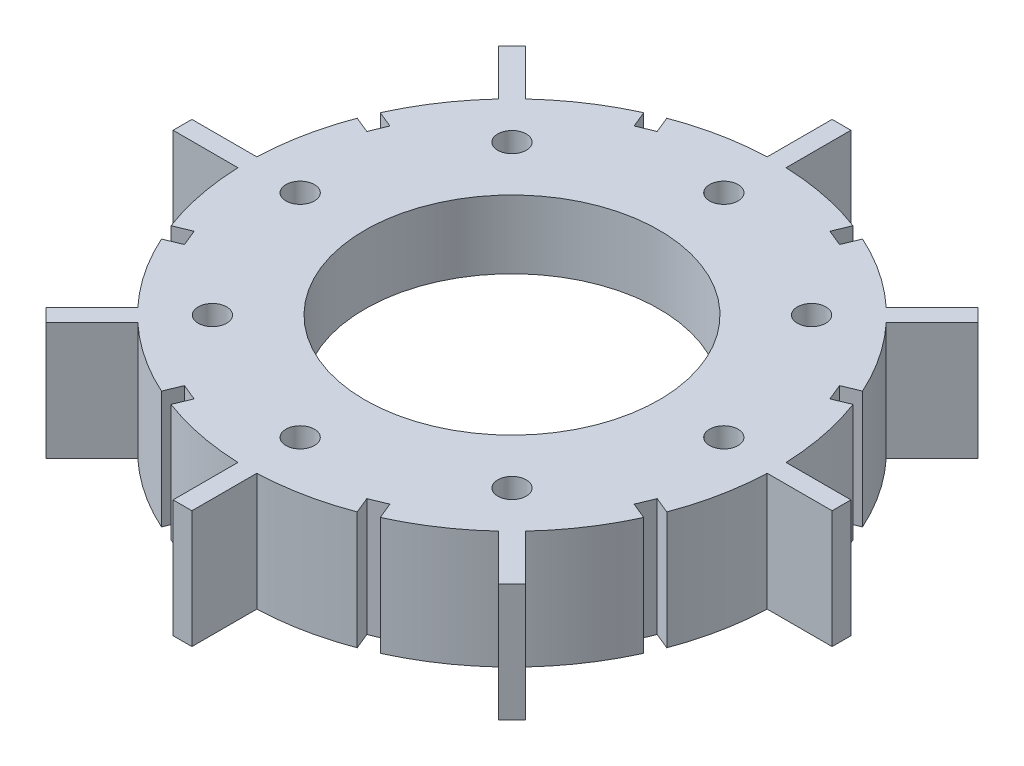
from build123d import *

# Parameters (mm, degrees)
SKETCH1_R           = 62.5
BOSS_EXTRUDE1_DEPTH = 25
SKETCH3_W           = 40
SKETCH3_H           = 21
SKETCH7_R           = 6.05
CUT_EXTRUDE1_DEPTH  = 205.205778567
SCALE1_SCALE        = 0.25


with BuildPart() as part:
    # Sketch1 → Boss-Extrude1 (new, symmetric)
    with BuildSketch(Plane(origin=(0, 0, 0), x_dir=(1, 0, 0), z_dir=(0, 1, 0))):
        with BuildLine():
            Line((95.514529523, 43.622384283), (102.443626017, 46.492510026))
            ThreePointArc((102.443626017, 46.492510026), (93.609761087, 62.397617177), (82.327640957, 76.670786708))
            Line((82.327640957, 76.670786708), (101.823376491, 96.166522241))
            Line((101.823376491, 96.166522241), (96.166522241, 101.823376491))
            Line((96.166522241, 101.823376491), (76.670786708, 82.327640957))
            ThreePointArc((76.670786708, 82.327640957), (62.397617177, 93.609761087), (46.492510026, 102.443626017))
            Line((46.492510026, 102.443626017), (43.622384283, 95.514529523))
            Line((43.622384283, 95.514529523), (36.693287789, 98.384655266))
            Line((36.693287789, 98.384655266), (39.563413532, 105.31375176))
            ThreePointArc((39.563413532, 105.31375176), (22.070318614, 110.313875085), (4, 112.4288664))
            Line((4, 112.4288664), (4, 140))
            Line((4, 140), (-4, 140))
            Line((-4, 140), (-4, 112.4288664))
            ThreePointArc((-4, 112.4288664), (-22.070318614, 110.313875085), (-39.563413532, 105.31375176))
            Line((-39.563413532, 105.31375176), (-36.693287789, 98.384655266))
            Line((-36.693287789, 98.384655266), (-43.622384283, 95.514529523))
            Line((-43.622384283, 95.514529523), (-46.492510026, 102.443626017))
            ThreePointArc((-46.492510026, 102.443626017), (-62.397617177, 93.609761087), (-76.670786708, 82.327640957))
            Line((-76.670786708, 82.327640957), (-96.166522241, 101.823376491))
            Line((-96.166522241, 101.823376491), (-101.823376491, 96.166522241))
            Line((-101.823376491, 96.166522241), (-82.327640957, 76.670786708))
            ThreePointArc((-82.327640957, 76.670786708), (-93.609761087, 62.397617177), (-102.443626017, 46.492510026))
            Line((-102.443626017, 46.492510026), (-95.514529523, 43.622384283))
            Line((-95.514529523, 43.622384283), (-98.384655266, 36.693287789))
            Line((-98.384655266, 36.693287789), (-105.31375176, 39.563413532))
            ThreePointArc((-105.31375176, 39.563413532), (-110.313875085, 22.070318614), (-112.4288664, 4))
            Line((-112.4288664, 4), (-140, 4))
            Line((-140, 4), (-140, -4))
            Line((-140, -4), (-112.4288664, -4))
            ThreePointArc((-112.4288664, -4), (-110.313875085, -22.070318614), (-105.31375176, -39.563413532))
            Line((-105.31375176, -39.563413532), (-98.384655266, -36.693287789))
            Line((-98.384655266, -36.693287789), (-95.514529523, -43.622384283))
            Line((-95.514529523, -43.622384283), (-102.443626017, -46.492510026))
            ThreePointArc((-102.443626017, -46.492510026), (-93.609761087, -62.397617177), (-82.327640957, -76.670786708))
            Line((-82.327640957, -76.670786708), (-101.823376491, -96.166522241))
            Line((-101.823376491, -96.166522241), (-96.166522241, -101.823376491))
            Line((-96.166522241, -101.823376491), (-76.670786708, -82.327640957))
            ThreePointArc((-76.670786708, -82.327640957), (-62.397617177, -93.609761087), (-46.492510026, -102.443626017))
            Line((-46.492510026, -102.443626017), (-43.622384283, -95.514529523))
            Line((-43.622384283, -95.514529523), (-36.693287789, -98.384655266))
            Line((-36.693287789, -98.384655266), (-39.563413532, -105.31375176))
            ThreePointArc((-39.563413532, -105.31375176), (-22.070318614, -110.313875085), (-4, -112.4288664))
            Line((-4, -112.4288664), (-4, -140))
            Line((-4, -140), (4, -140))
            Line((4, -140), (4, -112.4288664))
            ThreePointArc((4, -112.4288664), (22.070318614, -110.313875085), (39.563413532, -105.31375176))
            Line((39.563413532, -105.31375176), (36.693287789, -98.384655266))
            Line((36.693287789, -98.384655266), (43.622384283, -95.514529523))
            Line((43.622384283, -95.514529523), (46.492510026, -102.443626017))
            ThreePointArc((46.492510026, -102.443626017), (62.397617177, -93.609761087), (76.670786708, -82.327640957))
            Line((76.670786708, -82.327640957), (96.166522241, -101.823376491))
            Line((96.166522241, -101.823376491), (101.823376491, -96.166522241))
            Line((101.823376491, -96.166522241), (82.327640957, -76.670786708))
            ThreePointArc((82.327640957, -76.670786708), (93.609761087, -62.397617177), (102.443626017, -46.492510026))
            Line((102.443626017, -46.492510026), (95.514529523, -43.622384283))
            Line((95.514529523, -43.622384283), (98.384655266, -36.693287789))
            Line((98.384655266, -36.693287789), (105.31375176, -39.563413532))
            ThreePointArc((105.31375176, -39.563413532), (110.313875085, -22.070318614), (112.4288664, -4))
            Line((112.4288664, -4), (140, -4))
            Line((140, -4), (140, 4))
            Line((140, 4), (112.4288664, 4))
            ThreePointArc((112.4288664, 4), (110.313875085, 22.070318614), (105.31375176, 39.563413532))
            Line((105.31375176, 39.563413532), (98.384655266, 36.693287789))
            Line((98.384655266, 36.693287789), (95.514529523, 43.622384283))
        make_face()
        Circle(SKETCH1_R, mode=Mode.SUBTRACT)
    extrude(amount=BOSS_EXTRUDE1_DEPTH, both=True)

    # Sketch3 → Cut-Revolve1 (revolve, cut)
    with BuildSketch(Plane.XY):
        with Locations((-82.5, -14.5)):
            Rectangle(SKETCH3_W, SKETCH3_H)
    revolve(axis=Axis((0, 65.266274402, 0), (0, -1, 0)), mode=Mode.SUBTRACT)

    # Sketch7 → Cut-Extrude1 (cut, through all)
    with BuildSketch(Plane(origin=(0, 25, 0), x_dir=(1, 0, 0), z_dir=(0, 1, 0))):
        with Locations((0, 90)):
            Circle(SKETCH7_R)
        with Locations((63.639610307, 63.639610307)):
            Circle(SKETCH7_R)
        with Locations((90, 0)):
            Circle(SKETCH7_R)
        with Locations((63.639610307, -63.639610307)):
            Circle(SKETCH7_R)
        with Locations((0, -90)):
            Circle(SKETCH7_R)
        with Locations((-63.639610307, -63.639610307)):
            Circle(SKETCH7_R)
        with Locations((-90, 0)):
            Circle(SKETCH7_R)
        with Locations((-63.639610307, 63.639610307)):
            Circle(SKETCH7_R)
    extrude(amount=-CUT_EXTRUDE1_DEPTH, mode=Mode.SUBTRACT)


with BuildPart() as part_1:
    # Scale1: scaled about (0, 6.17055907, 0)
    add(part.part.scale(SCALE1_SCALE).moved(Location((0, 4.627919303, 0))))


solid = part_1.part
